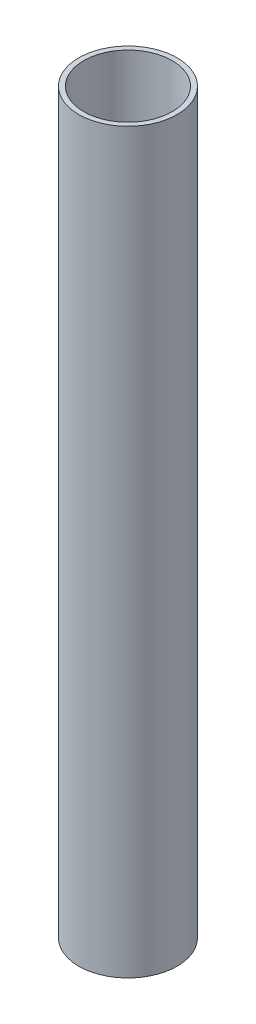
from build123d import *

# Parameters (mm, degrees)
SKETCH2_R           = 10
SKETCH2_R_2         = 9
BOSS_EXTRUDE1_DEPTH = 75


with BuildPart() as part:
    # Sketch2 → Boss-Extrude1 (new, symmetric)
    with BuildSketch(Plane(origin=(0, 0, 0), x_dir=(1, 0, 0), z_dir=(0, 1, 0))):
        with Locations(Location((0, 0, 0), (0, 0, 270))):
            Circle(SKETCH2_R)
        with Locations(Location((0, 0, 0), (0, 0, 270))):
            Circle(SKETCH2_R_2, mode=Mode.SUBTRACT)
    extrude(amount=BOSS_EXTRUDE1_DEPTH, both=True)


solid = part.part
